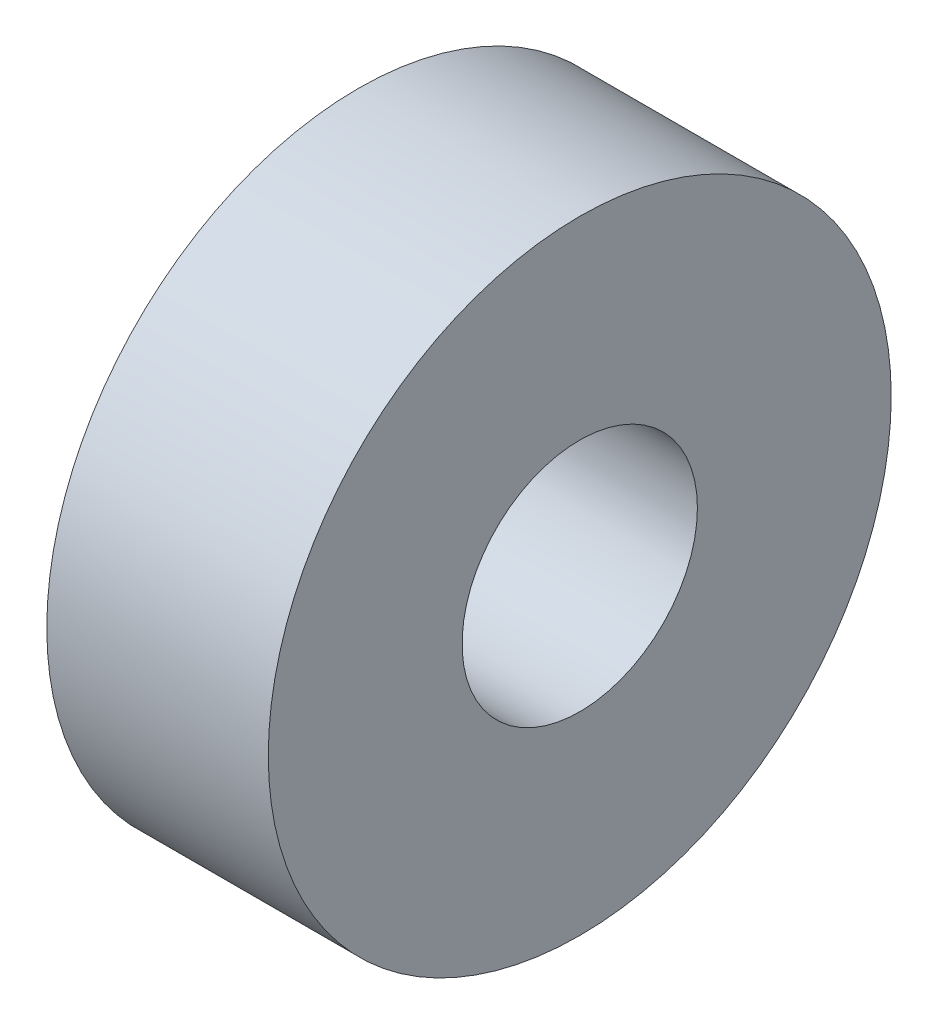
from build123d import *

# Parameters (mm, degrees)
SKETCH_1_R      = 11.25
SKETCH_1_R_2    = 4.25
EXTRUDE_1_DEPTH = 4


with BuildPart() as part:
    # Эскиз1 → Бобышка-Вытянуть1 (new, symmetric)
    with BuildSketch(Plane(origin=(0, 0, 0), x_dir=(0, 0, -1), z_dir=(1, 0, 0))):
        Circle(SKETCH_1_R)
        Circle(SKETCH_1_R_2, mode=Mode.SUBTRACT)
    extrude(amount=EXTRUDE_1_DEPTH, both=True)


solid = part.part
